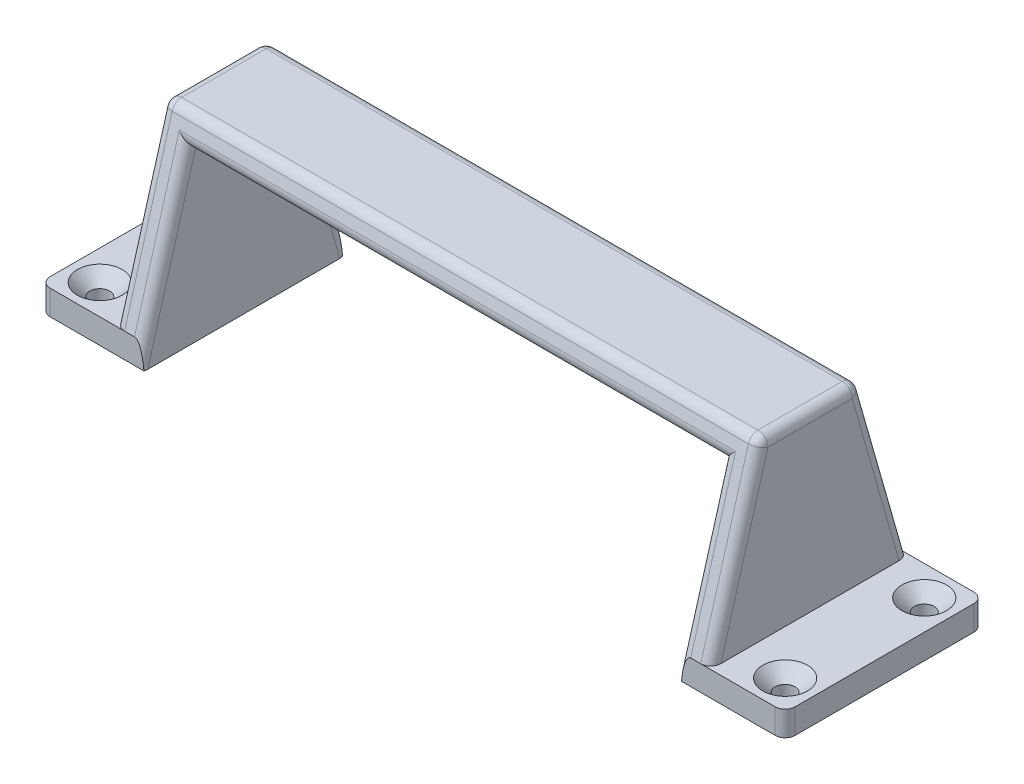
from build123d import *

# Parameters (mm, degrees)
SKETCH_1_W          = 150
SKETCH_1_H          = 40
EXTRUDE_1_DEPTH     = 40
CUT_EXTRUDE_1_REACH = 162.312
SKETCH_2_W          = 15
SKETCH_2_H          = 35
CUT_EXTRUDE_2_REACH = 162.312
SKETCH_3_W          = 108
SKETCH_3_H          = 34
CUT_EXTRUDE_3_REACH = 148.373
SKETCH_5_R          = 2
CUT_EXTRUDE_4_DEPTH = 5
CHAMFER_1_SIZE      = 2.5
FILLET_2_R          = 2
FILLET_3_R          = 2


with BuildPart() as part:
    # 草图1 → 凸台-拉伸1 (new body)
    with BuildSketch(Plane.XY):
        with Locations((75, 20)):
            Rectangle(SKETCH_1_W, SKETCH_1_H)
    extrude(amount=EXTRUDE_1_DEPTH)

    # 草图2 → 切除-拉伸1 (cut, up to next)
    with BuildSketch(Plane(origin=(0, 0, 0), x_dir=(-1, 0, 0), z_dir=(0, 0, -1)), mode=Mode.PRIVATE) as cut_extrude_1_sk1:
        with Locations((-142.5, 22.5)):
            Rectangle(SKETCH_2_W, SKETCH_2_H)
    cut_extrude_1_tool1 = extrude(cut_extrude_1_sk1.sketch, amount=-CUT_EXTRUDE_1_REACH, mode=Mode.PRIVATE) & part.part
    # 草图2 → 切除-拉伸1 (cut, up to next)
    with BuildSketch(Plane(origin=(0, 0, 0), x_dir=(-1, 0, 0), z_dir=(0, 0, -1)), mode=Mode.PRIVATE) as cut_extrude_1_sk2:
        with Locations((-7.5, 22.5)):
            Rectangle(SKETCH_2_W, SKETCH_2_H)
    cut_extrude_1_tool2 = extrude(cut_extrude_1_sk2.sketch, amount=-CUT_EXTRUDE_1_REACH, mode=Mode.PRIVATE) & part.part
    add(cut_extrude_1_tool1.solids().sort_by_distance((142.5, 22.5, 0))[0], mode=Mode.SUBTRACT)
    add(cut_extrude_1_tool2.solids().sort_by_distance((7.5, 22.5, 0))[0], mode=Mode.SUBTRACT)

    # 草图3 → 切除-拉伸2 (cut, up to next)
    with BuildSketch(Plane(origin=(0, 0, 0), x_dir=(-1, 0, 0), z_dir=(0, 0, -1)), mode=Mode.PRIVATE) as cut_extrude_2_sk1:
        with Locations((-75, 17)):
            Rectangle(SKETCH_3_W, SKETCH_3_H)
    cut_extrude_2_tool1 = extrude(cut_extrude_2_sk1.sketch, amount=-CUT_EXTRUDE_2_REACH, mode=Mode.PRIVATE) & part.part
    add(cut_extrude_2_tool1.solids().sort_by_distance((75, 17, 0))[0], mode=Mode.SUBTRACT)

    # 切除-拉伸3: up to this face of the body (flat: up to its plane)
    cut_extrude_3_end = Plane(part.part.faces().sort_by_distance((15, 22.5, 20))[0])
    # 草图4 → 切除-拉伸3 (cut, up to the picked face)
    with BuildSketch(Plane(origin=(135, 0, 0), x_dir=(0, 0, -1), z_dir=(1, 0, 0)), mode=Mode.PRIVATE) as cut_extrude_3_sk1:
        Polygon((-40, 40), (-40, 5), (-30, 40), align=None)
    cut_extrude_3_tool1 = split(extrude(cut_extrude_3_sk1.sketch, amount=-CUT_EXTRUDE_3_REACH, mode=Mode.PRIVATE), bisect_by=cut_extrude_3_end, keep=Keep.BOTH, mode=Mode.PRIVATE)
    # 草图4 → 切除-拉伸3 (cut, up to the picked face)
    with BuildSketch(Plane(origin=(135, 0, 0), x_dir=(0, 0, -1), z_dir=(1, 0, 0)), mode=Mode.PRIVATE) as cut_extrude_3_sk2:
        Polygon((-10, 40), (0, 40), (0, 5), align=None)
    cut_extrude_3_tool2 = split(extrude(cut_extrude_3_sk2.sketch, amount=-CUT_EXTRUDE_3_REACH, mode=Mode.PRIVATE), bisect_by=cut_extrude_3_end, keep=Keep.BOTH, mode=Mode.PRIVATE)
    add(cut_extrude_3_tool1.solids().sort_by(Axis((135, 28.333333, 36.666667), (-1, 0, 0)))[0], mode=Mode.SUBTRACT)
    add(cut_extrude_3_tool2.solids().sort_by(Axis((135, 28.333333, 3.333333), (-1, 0, 0)))[0], mode=Mode.SUBTRACT)

    # 草图5 → 切除-拉伸4 (cut)
    with BuildSketch(Plane.XZ):
        with Locations(Location((6, 6, 0), (0, 0, 270))):
            Circle(SKETCH_5_R)
        with Locations(Location((6, 34, 0), (0, 0, 270))):
            Circle(SKETCH_5_R)
    cut_extrude_4 = extrude(amount=-CUT_EXTRUDE_4_DEPTH, mode=Mode.SUBTRACT)

    # 镜向5: 切除-拉伸4 across plane
    add(cut_extrude_4.mirror(Plane.ZY.offset(-75)), mode=Mode.SUBTRACT)

    # 倒角1
    chamfer_1_edges = [part.edges().sort_by_distance(p)[0] for p in [
        (144, 5, 36),
        (6, 5, 8),
        (6, 5, 36),
        (144, 5, 8),
    ]]
    chamfer(chamfer_1_edges, length=CHAMFER_1_SIZE)

    # 圆角2
    fillet_2_edges = [part.edges().sort_by_distance(p)[0] for p in [
        (135, 22.5, 5),
        (135, 40, 20),
        (135, 22.5, 35),
        (15, 22.5, 35),
        (15, 40, 20),
        (15, 22.5, 5),
        (75, 40, 10),
        (75, 40, 30),
        (21, 19.5, 4.142857143),
        (75, 34, 8.285714286),
        (129, 19.5, 4.142857143),
        (129, 19.5, 35.857142857),
        (21, 19.5, 35.857142857),
        (75, 34, 31.714285714),
    ]]
    fillet(fillet_2_edges, radius=FILLET_2_R)

    # 圆角3
    fillet_3_edges = [part.edges().sort_by_distance(p)[0] for p in [
        (150, 2.5, 40),
        (0, 2.5, 0),
        (0, 2.5, 40),
        (150, 2.5, 0),
    ]]
    fillet(fillet_3_edges, radius=FILLET_3_R)


solid = part.part
